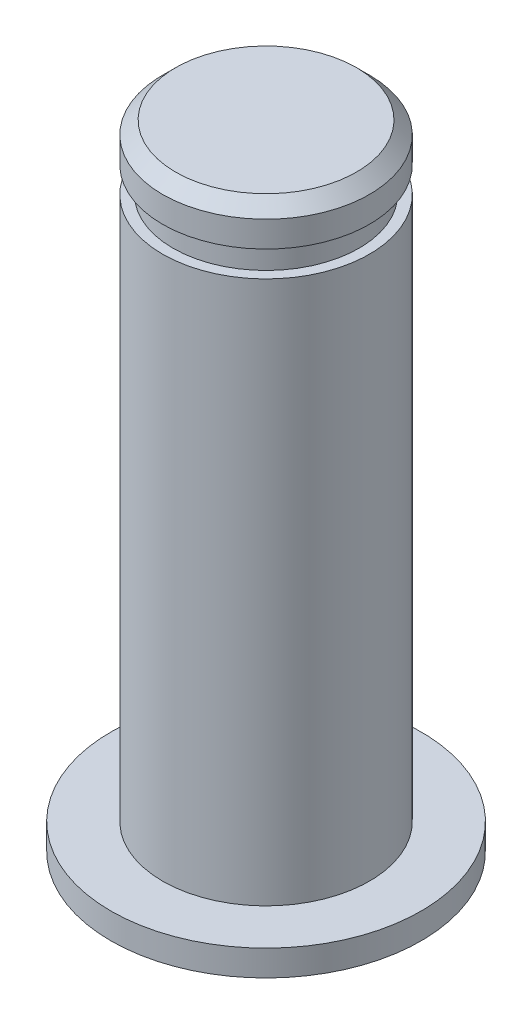
from build123d import *

# Parameters (mm, degrees)
CHAMFER_1_SIZE = 0.5


with BuildPart() as part:
    # Эскиз1 → Повернуть1 (revolve)
    with BuildSketch(Plane.XY, mode=Mode.PRIVATE) as revolve_1_sk:
        Polygon((-4, 24.5), (0, 24.5), (0, 0), (-6, 0), (-6, 1), (-4, 1), (-4, 22), (-3.6, 22), (-3.6, 23), (-4, 23), align=None)
    revolve(revolve_1_sk.sketch.rotate(Axis((0, 0, 0), (0, -1, 0)), 270), axis=Axis((0, 0, 0), (0, -1, 0)))

    # Фаска1
    chamfer_1_edges = [part.edges().sort_by_distance(p)[0] for p in [
        (0, 24.5, -4),
    ]]
    chamfer(chamfer_1_edges, length=CHAMFER_1_SIZE)


solid = part.part
